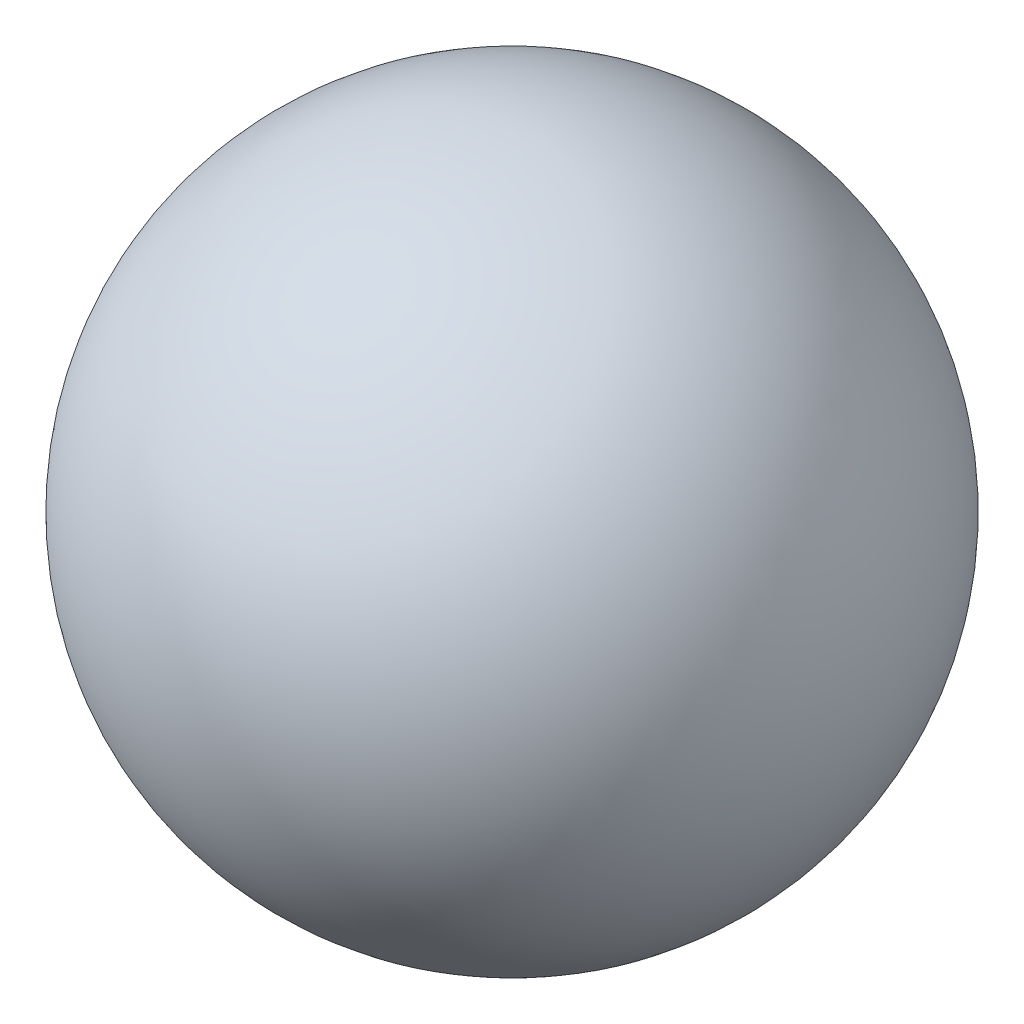
from build123d import *


with BuildPart() as part:
    # Sketch1 → Revolve1 (revolve)
    with BuildSketch(Plane.XY):
        with BuildLine():
            Line((0, 25.4), (0, -25.4))
            ThreePointArc((0, -25.4), (-25.4, 0), (0, 25.4))
        make_face()
    revolve(axis=Axis((0, 25.4, 0), (0, -1, 0)))


solid = part.part
